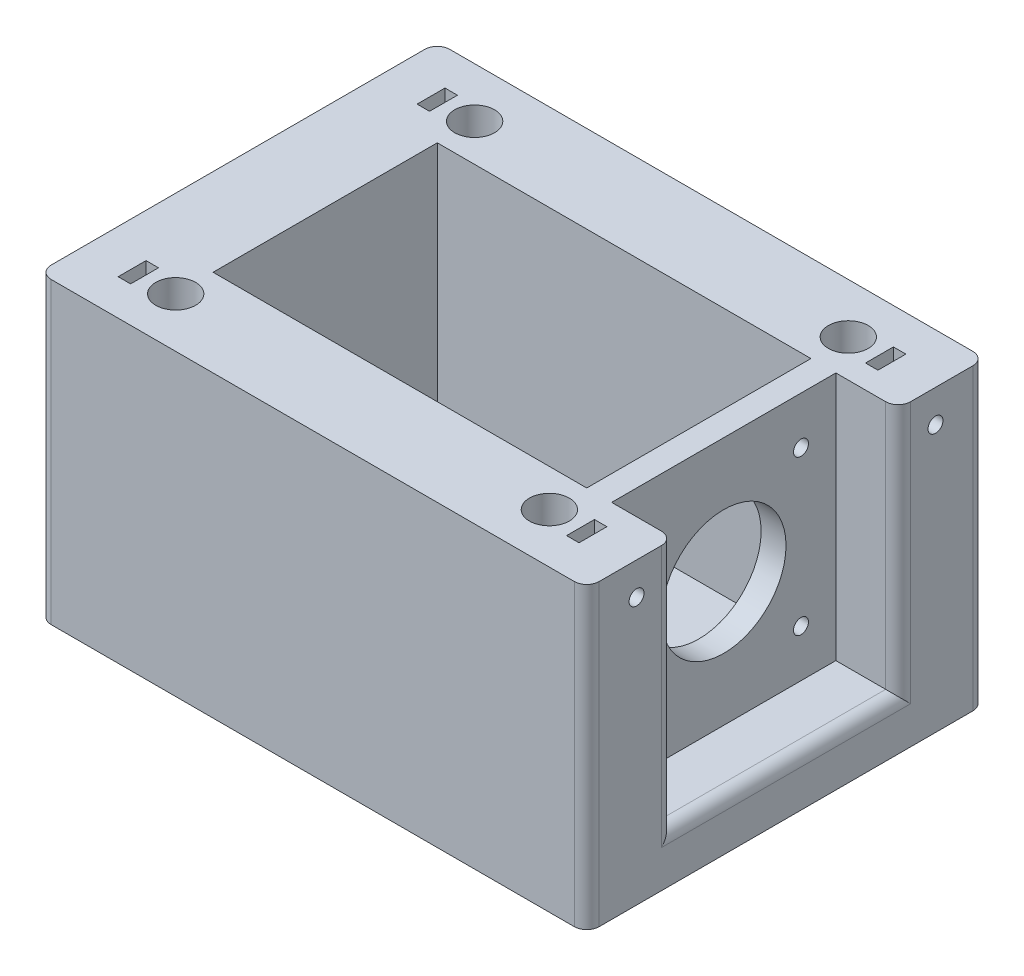
from build123d import *
from build123d.topology import SkipClean

# Parameters (mm, degrees)
SKETCH1_W           = 110
SKETCH1_H           = 80
BOSS_EXTRUDE1_DEPTH = 60
SKETCH2_W           = 75
SKETCH2_H           = 45
SKETCH2_W_2         = 12.5
CUT_EXTRUDE2_DEPTH  = 50
SKETCH4_W           = 1.25
SKETCH4_H           = 2.8
CUT_EXTRUDE3_DEPTH  = 10
SKETCH5_R           = 1.5
CUT_EXTRUDE4_DEPTH  = 117
SKETCH6_R           = 12.5
CUT_EXTRUDE5_DEPTH  = 5
FILLET1_R           = 2.5


with BuildPart() as part:
    # Sketch1 → Boss-Extrude1 (new body)
    with BuildSketch(Plane(origin=(0, 0, 0), x_dir=(1, 0, 0), z_dir=(0, 1, 0))):
        Rectangle(SKETCH1_W, SKETCH1_H)
    extrude(amount=BOSS_EXTRUDE1_DEPTH)

    # Sketch2 → Cut-Extrude2 (cut)
    with BuildSketch(Plane(origin=(0, 60, 0), x_dir=(1, 0, 0), z_dir=(0, 1, 0))):
        Rectangle(SKETCH2_W, SKETCH2_H)
        with BuildLine():
            ThreePointArc((-33.5, 30), (-40.328427125, 32.828427125), (-37.5, 26))
            Line((-37.5, 26), (-37.5, 30))
            Line((-37.5, 30), (-33.5, 30))
        make_face()
        with BuildLine():
            Line((-37.5, 30), (-37.5, 26))
            ThreePointArc((-37.5, 26), (-34.671572875, 27.171572875), (-33.5, 30))
            Line((-33.5, 30), (-37.5, 30))
        make_face()
        with BuildLine():
            ThreePointArc((33.5, 30), (34.671572875, 27.171572875), (37.5, 26))
            Line((37.5, 26), (37.5, 30))
            Line((37.5, 30), (33.5, 30))
        make_face()
        with BuildLine():
            Line((37.5, 30), (37.5, 26))
            ThreePointArc((37.5, 26), (40.328427125, 27.171572875), (41.5, 30))
            ThreePointArc((41.5, 30), (37.5, 34), (33.5, 30))
            Line((33.5, 30), (37.5, 30))
        make_face()
        with BuildLine():
            ThreePointArc((-33.5, -30), (-34.671572875, -27.171572875), (-37.5, -26))
            Line((-37.5, -26), (-37.5, -30))
            Line((-37.5, -30), (-33.5, -30))
        make_face()
        with BuildLine():
            Line((-37.5, -30), (-37.5, -26))
            ThreePointArc((-37.5, -26), (-40.328427125, -32.828427125), (-33.5, -30))
            Line((-33.5, -30), (-37.5, -30))
        make_face()
        with BuildLine():
            ThreePointArc((41.5, -30), (40.328427125, -27.171572875), (37.5, -26))
            Line((37.5, -26), (37.5, -30))
            Line((37.5, -30), (33.5, -30))
            ThreePointArc((33.5, -30), (37.5, -34), (41.5, -30))
        make_face()
        with BuildLine():
            Line((37.5, -30), (37.5, -26))
            ThreePointArc((37.5, -26), (34.671572875, -27.171572875), (33.5, -30))
            Line((33.5, -30), (37.5, -30))
        make_face()
        with Locations((48.75, 0)):
            Rectangle(SKETCH2_W_2, SKETCH2_H)
    extrude(amount=-CUT_EXTRUDE2_DEPTH, mode=Mode.SUBTRACT)

    # Sketch4 → Cut-Extrude3 (cut)
    with BuildSketch(Plane(origin=(0, 60, 0), x_dir=(1, 0, 0), z_dir=(0, 1, 0))):
        Polygon((-45, 27.2), (-45, 30), (-43.75, 30), (-43.75, 32.8), (-46.25, 32.8), (-46.25, 27.2), align=None)
        with Locations((-44.375, 28.6)):
            Rectangle(SKETCH4_W, SKETCH4_H)
        Polygon((-45, -30), (-45, -27.2), (-46.25, -27.2), (-46.25, -32.8), (-43.75, -32.8), (-43.75, -30), align=None)
        with Locations((-44.375, -28.6)):
            Rectangle(SKETCH4_W, SKETCH4_H)
        with Locations((44.375, -28.6)):
            Rectangle(SKETCH4_W, SKETCH4_H)
        Polygon((46.25, -27.2), (45, -27.2), (45, -30), (43.75, -30), (43.75, -32.8), (46.25, -32.8), align=None)
        Polygon((43.75, 32.8), (43.75, 30), (45, 30), (45, 27.2), (46.25, 27.2), (46.25, 32.8), align=None)
        with Locations((44.375, 28.6)):
            Rectangle(SKETCH4_W, SKETCH4_H)
    extrude(amount=-CUT_EXTRUDE3_DEPTH, mode=Mode.SUBTRACT)

    # Sketch5 → Cut-Extrude4 (cut)
    with SkipClean():  # the faces are left unmerged after this step: merging them gives an invalid solid
        with BuildSketch(Plane(origin=(55, 0, 0), x_dir=(0, 0, -1), z_dir=(1, 0, 0))):
            with Locations((-30, 53.5)):
                Circle(SKETCH5_R)
            with Locations((30, 53.5)):
                Circle(SKETCH5_R)
        extrude(amount=-CUT_EXTRUDE4_DEPTH, mode=Mode.SUBTRACT)

    # Sketch6 → Cut-Extrude5 (cut)
    with SkipClean():  # the faces are left unmerged after this step: merging them gives an invalid solid
        with BuildSketch(Plane(origin=(42.5, 0, 0), x_dir=(0, 0, -1), z_dir=(1, 0, 0))):
            with Locations((0, 35)):
                Circle(SKETCH6_R)
            with BuildLine():
                Line((-15.5, 49), (-15.5, 50.5))
                Line((-15.5, 50.5), (-14, 50.5))
                ThreePointArc((-14, 50.5), (-16.560660172, 51.560660172), (-15.5, 49))
            make_face()
            with BuildLine():
                Line((-14, 50.5), (-15.5, 50.5))
                Line((-15.5, 50.5), (-15.5, 49))
                ThreePointArc((-15.5, 49), (-14.439339828, 49.439339828), (-14, 50.5))
            make_face()
            with BuildLine():
                ThreePointArc((17, 50.5), (15.5, 52), (14, 50.5))
                Line((14, 50.5), (15.5, 50.5))
                Line((15.5, 50.5), (15.5, 49))
                ThreePointArc((15.5, 49), (16.560660172, 49.439339828), (17, 50.5))
            make_face()
            with BuildLine():
                Line((15.5, 50.5), (14, 50.5))
                ThreePointArc((14, 50.5), (14.439339828, 49.439339828), (15.5, 49))
                Line((15.5, 49), (15.5, 50.5))
            make_face()
            with BuildLine():
                ThreePointArc((17, 19.5), (16.560660172, 20.560660172), (15.5, 21))
                Line((15.5, 21), (15.5, 19.5))
                Line((15.5, 19.5), (14, 19.5))
                ThreePointArc((14, 19.5), (15.5, 18), (17, 19.5))
            make_face()
            with BuildLine():
                Line((15.5, 19.5), (15.5, 21))
                ThreePointArc((15.5, 21), (14.439339828, 20.560660172), (14, 19.5))
                Line((14, 19.5), (15.5, 19.5))
            make_face()
            with BuildLine():
                ThreePointArc((-14, 19.5), (-14.439339828, 20.560660172), (-15.5, 21))
                Line((-15.5, 21), (-15.5, 19.5))
                Line((-15.5, 19.5), (-14, 19.5))
            make_face()
            with BuildLine():
                Line((-15.5, 19.5), (-15.5, 21))
                ThreePointArc((-15.5, 21), (-16.560660172, 18.439339828), (-14, 19.5))
                Line((-14, 19.5), (-15.5, 19.5))
            make_face()
        extrude(amount=-CUT_EXTRUDE5_DEPTH, mode=Mode.SUBTRACT)

    # Fillet1
    fillet1_edges = [part.edges().sort_by_distance(p)[0] for p in [
        (55, 10, 0),
        (55, 35, -22.5),
        (55, 35, 22.5),
        (55, 30, 40),
        (-55, 30, 40),
        (-55, 30, -40),
        (55, 30, -40),
    ]]
    fillet(fillet1_edges, radius=FILLET1_R)


solid = part.part
